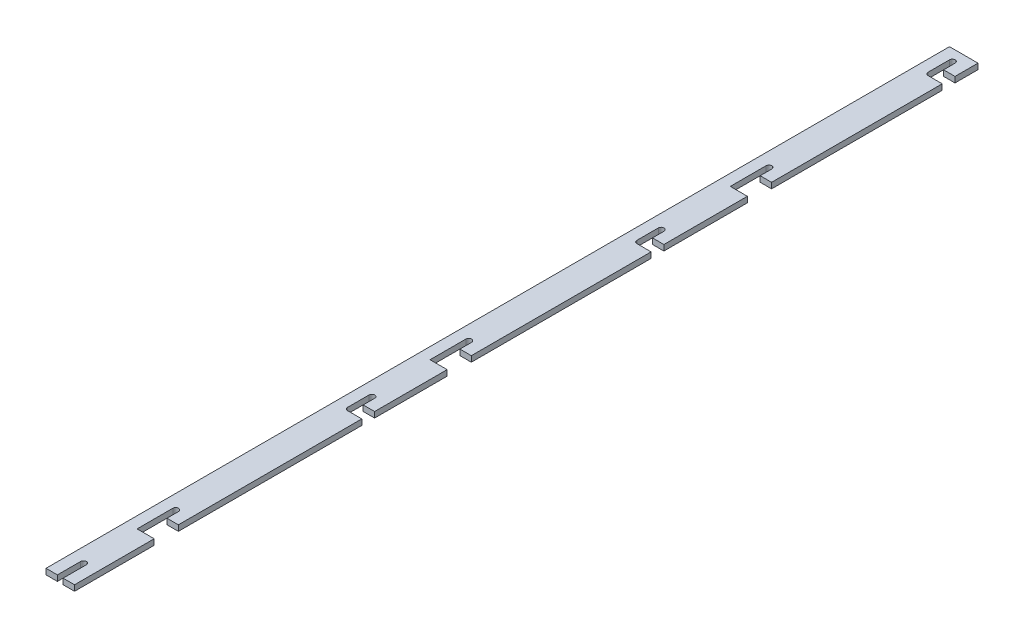
from build123d import *

# Parameters (mm, degrees)
SKETCH1_W           = 7.9375
SKETCH1_H           = 251.46
BOSS_EXTRUDE1_DEPTH = 1.5875
CUT_EXTRUDE1_DEPTH  = 1.5875


with BuildPart() as part:
    # Sketch1 → Boss-Extrude1 (new body)
    with BuildSketch(Plane(origin=(0, 0, 0), x_dir=(1, 0, 0), z_dir=(0, 1, 0))):
        with Locations((3.96875, 125.73)):
            Rectangle(SKETCH1_W, SKETCH1_H)
    extrude(amount=BOSS_EXTRUDE1_DEPTH)

    # Sketch2 → Cut-Extrude1 (cut)
    with BuildSketch(Plane(origin=(0, 1.5875, 0), x_dir=(1, 0, 0), z_dir=(0, 1, 0))):
        with BuildLine():
            Line((7.9375, 245.0592), (4.7625, 245.0592))
            Line((4.7625, 245.0592), (4.7625, 248.285))
            ThreePointArc((4.7625, 248.285), (3.96875, 249.07875), (3.175, 248.285))
            Line((3.175, 248.285), (3.175, 242.29695))
            ThreePointArc((3.175, 242.29695), (3.407483992, 241.735683992), (3.96875, 241.5032))
            Line((3.96875, 241.5032), (7.9375, 241.5032))
            Line((7.9375, 241.5032), (7.9375, 245.0592))
        make_face()
        with BuildLine():
            Line((7.9375, 194.0052), (4.7625, 194.0052))
            Line((4.7625, 194.0052), (4.7625, 197.231))
            ThreePointArc((4.7625, 197.231), (3.96875, 198.02475), (3.175, 197.231))
            Line((3.175, 197.231), (3.175, 191.24295))
            Line((3.175, 191.24295), (3.175, 187.2742))
            Line((3.175, 187.2742), (7.9375, 187.2742))
            Line((7.9375, 187.2742), (7.9375, 190.4492))
            Line((7.9375, 190.4492), (7.9375, 194.0052))
        make_face()
        with BuildLine():
            Line((7.9375, 103.7082), (3.175, 103.7082))
            Line((3.175, 103.7082), (3.175, 107.67695))
            Line((3.175, 107.67695), (3.175, 113.665))
            ThreePointArc((3.175, 113.665), (3.96875, 114.45875), (4.7625, 113.665))
            Line((4.7625, 113.665), (4.7625, 110.4392))
            Line((4.7625, 110.4392), (7.9375, 110.4392))
            Line((7.9375, 110.4392), (7.9375, 106.8832))
            Line((7.9375, 106.8832), (7.9375, 103.7082))
        make_face()
        with BuildLine():
            Line((7.9375, 160.4772), (7.9375, 164.0332))
            Line((7.9375, 164.0332), (4.7625, 164.0332))
            Line((4.7625, 164.0332), (4.7625, 167.259))
            ThreePointArc((4.7625, 167.259), (3.96875, 168.05275), (3.175, 167.259))
            Line((3.175, 167.259), (3.175, 161.27095))
            ThreePointArc((3.175, 161.27095), (3.407483992, 160.709683992), (3.96875, 160.4772))
            Line((3.96875, 160.4772), (7.9375, 160.4772))
        make_face()
        with BuildLine():
            Line((7.9375, 22.1742), (3.175, 22.1742))
            Line((3.175, 22.1742), (3.175, 26.14295))
            Line((3.175, 26.14295), (3.175, 32.131))
            ThreePointArc((3.175, 32.131), (3.96875, 32.92475), (4.7625, 32.131))
            Line((4.7625, 32.131), (4.7625, 28.9052))
            Line((4.7625, 28.9052), (7.9375, 28.9052))
            Line((7.9375, 28.9052), (7.9375, 25.3492))
            Line((7.9375, 25.3492), (7.9375, 22.1742))
        make_face()
        with BuildLine():
            Line((7.9375, 83.5152), (4.7625, 83.5152))
            Line((4.7625, 83.5152), (4.7625, 86.741))
            ThreePointArc((4.7625, 86.741), (3.96875, 87.53475), (3.175, 86.741))
            Line((3.175, 86.741), (3.175, 80.75295))
            ThreePointArc((3.175, 80.75295), (3.407483992, 80.191683992), (3.96875, 79.9592))
            Line((3.96875, 79.9592), (7.9375, 79.9592))
            Line((7.9375, 79.9592), (7.9375, 83.5152))
        make_face()
        with BuildLine():
            Line((3.175, 6.477), (3.175, -0.907374529))
            Line((3.175, -0.907374529), (4.7625, -0.907374529))
            Line((4.7625, -0.907374529), (4.7625, 6.477))
            ThreePointArc((4.7625, 6.477), (3.96875, 7.27075), (3.175, 6.477))
        make_face()
    extrude(amount=-CUT_EXTRUDE1_DEPTH, mode=Mode.SUBTRACT)


solid = part.part
